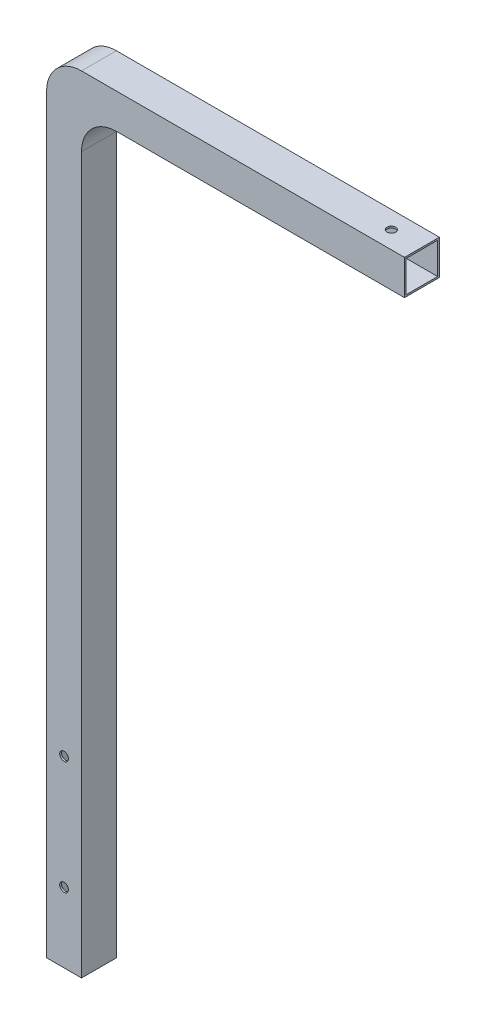
from build123d import *

# Parameters (mm, degrees)
BOSS_EXTRUDE1_DEPTH       = 50.8
FILLET1_R                 = 50.8
SHELL1_T                  = -2.54
SKETCH2_W                 = 45.72
SKETCH2_H                 = 45.72
CUT_EXTRUDE1_DEPTH        = 50.8
F_97_0_5_DIAMETER_HOLE1_D = 12.7
F_97_0_5_DIAMETER_HOLE2_D = 12.7


with BuildPart() as part:
    # Sketch1 → Boss-Extrude1 (new body)
    with BuildSketch(Plane.XY):
        Polygon((0, 0), (0, 1143), (520.7, 1143), (520.7, 1092.2), (50.8, 1092.2), (50.8, 0), align=None)
    extrude(amount=BOSS_EXTRUDE1_DEPTH)

    # Fillet1
    fillet1_edges = [part.edges().sort_by_distance(p)[0] for p in [
        (0, 1143, 25.4),
        (50.8, 1092.2, 25.4),
    ]]
    fillet(fillet1_edges, radius=FILLET1_R)

    # Shell1
    shell1_openings = [part.faces().sort_by_distance(p)[0] for p in [
        (520.7, 1117.6, 25.4),
    ]]
    offset(amount=SHELL1_T, openings=shell1_openings, kind=Kind.INTERSECTION)

    # Sketch2 → Cut-Extrude1 (cut)
    with BuildSketch(Plane.XZ):
        with Locations((25.4, 25.4)):
            Rectangle(SKETCH2_W, SKETCH2_H)
    extrude(amount=-CUT_EXTRUDE1_DEPTH, mode=Mode.SUBTRACT)

    # #97 (0.5) Diameter Hole1 (through all)
    with Locations(Plane(origin=(476.25, 1143, 25.4), x_dir=(0, 0, 1), z_dir=(0, 1, 0))):
        with Locations((0, 0)):
            Hole(F_97_0_5_DIAMETER_HOLE1_D / 2)

    # #97 (0.5) Diameter Hole2 (through all)
    with Locations(Plane(origin=(25.4, 101.6, 50.8), x_dir=(1, 0, 0), z_dir=(0, 0, 1))):
        with Locations((0, 0), (0, 165.1)):
            Hole(F_97_0_5_DIAMETER_HOLE2_D / 2)


solid = part.part
